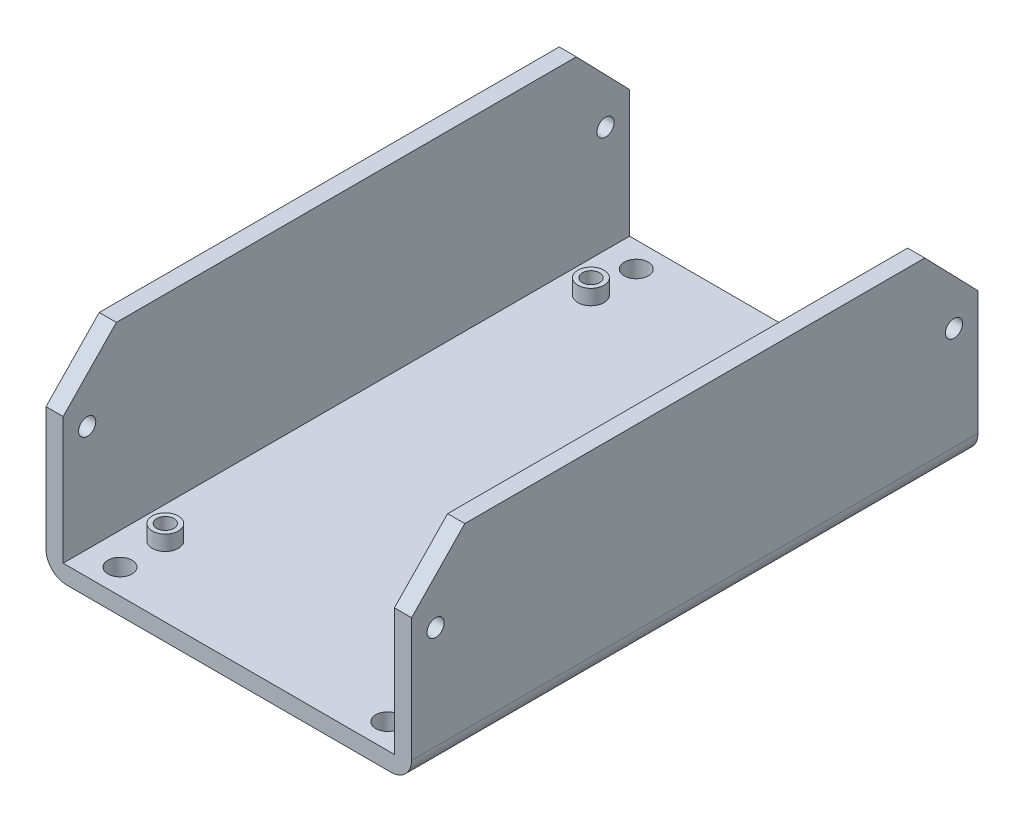
from build123d import *

# Parameters (mm, degrees)
EXTRUDE_1_DEPTH          = 41.25
CUT_EXTRUDE_1_DEPTH      = 58.02151458
CUT_EXTRUDE_1_DEPTH_BACK = 58.02151458
SKETCH_4_R               = 1.75
CUT_EXTRUDE_2_DEPTH      = 10
HOLE_WIZARD_M31_REACH    = 75.336
HOLE_WIZARD_M31_BORE_R   = 1.25
HOLE_WIZARD_M32_D        = 2.5
SKETCH_10_R              = 1.9
EXTRUDE_2_DEPTH          = 2.2
HOLE_WIZARD_M33_D        = 2.5


with BuildPart() as part:
    # Эскиз1 → Бобышка-Вытянуть1 (new, symmetric)
    with BuildSketch(Plane.XY):
        with BuildLine():
            Line((-26.625, 29), (-26.625, 3))
            ThreePointArc((-26.625, 3), (-25.746320344, 0.878679656), (-23.625, 0))
            Line((-23.625, 0), (23.625, 0))
            ThreePointArc((23.625, 0), (25.746320344, 0.878679656), (26.625, 3))
            Line((26.625, 3), (26.625, 29))
            Line((26.625, 29), (24.125, 29))
            Line((24.125, 29), (24.125, 2.5))
            Line((24.125, 2.5), (-24.125, 2.5))
            Line((-24.125, 2.5), (-24.125, 29))
            Line((-24.125, 29), (-26.625, 29))
        make_face()
    extrude(amount=EXTRUDE_1_DEPTH, both=True)

    # Эскиз3 → Вырез-Вытянуть1 (cut, two sides: drawn at the far end of the back side and taken through both)
    with BuildSketch(Plane(origin=(0, 0, 0), x_dir=(0, 0, -1), z_dir=(1, 0, 0)).offset(-CUT_EXTRUDE_1_DEPTH_BACK)):
        Polygon((41.25, 21), (41.25, 29), (33.5, 29), align=None)
        Polygon((-41.25, 21), (-41.25, 29), (-33.5, 29), align=None)
    extrude(amount=CUT_EXTRUDE_1_DEPTH + CUT_EXTRUDE_1_DEPTH_BACK, mode=Mode.SUBTRACT)

    # Эскиз4 → Вырез-Вытянуть2 (cut)
    with BuildSketch(Plane.XZ):
        with Locations((-19.5, -37.6)):
            Circle(SKETCH_4_R)
        with Locations((-19.5, 37.6)):
            Circle(SKETCH_4_R)
        with Locations((19.5, 37.6)):
            Circle(SKETCH_4_R)
        with Locations((19.5, -37.6)):
            Circle(SKETCH_4_R)
    extrude(amount=-CUT_EXTRUDE_2_DEPTH, mode=Mode.SUBTRACT)

    # Отверстие обработанное метчиком M31 bore → Отверстие обработанное метчиком M31 (cut, up to next)
    with BuildSketch(Plane(origin=(26.625, 0, 0), x_dir=(0, 0, -1), z_dir=(1, 0, 0)), mode=Mode.PRIVATE) as hole_wizard_m31_sk1:
        with Locations((37.75, 18)):
            Circle(HOLE_WIZARD_M31_BORE_R)
    hole_wizard_m31_tool1 = extrude(hole_wizard_m31_sk1.sketch, amount=-HOLE_WIZARD_M31_REACH, mode=Mode.PRIVATE) & part.part
    # Отверстие обработанное метчиком M31 bore → Отверстие обработанное метчиком M31 (cut, up to next)
    with BuildSketch(Plane(origin=(26.625, 0, 0), x_dir=(0, 0, -1), z_dir=(1, 0, 0)), mode=Mode.PRIVATE) as hole_wizard_m31_sk2:
        with Locations((-37.75, 18)):
            Circle(HOLE_WIZARD_M31_BORE_R)
    hole_wizard_m31_tool2 = extrude(hole_wizard_m31_sk2.sketch, amount=-HOLE_WIZARD_M31_REACH, mode=Mode.PRIVATE) & part.part
    add(hole_wizard_m31_tool1.solids().sort_by_distance((26.625, 18, -37.75))[0], mode=Mode.SUBTRACT)
    add(hole_wizard_m31_tool2.solids().sort_by_distance((26.625, 18, 37.75))[0], mode=Mode.SUBTRACT)

    # Отверстие обработанное метчиком M32 (through all)
    with Locations(Plane.ZY.offset(26.625)):
        with Locations((-37.75, 18), (37.75, 18)):
            Hole(HOLE_WIZARD_M32_D / 2)

    # Эскиз10 → Бобышка-Вытянуть2 (add)
    with BuildSketch(Plane(origin=(0, 2.5, 0), x_dir=(1, 0, 0), z_dir=(0, 1, 0))):
        with Locations(Location((19.5, 31, 0), (0, 0, 90))):
            Circle(SKETCH_10_R)
        with Locations(Location((19.5, -31, 0), (0, 0, 90))):
            Circle(SKETCH_10_R)
        with Locations(Location((-19.5, -31, 0), (0, 0, 90))):
            Circle(SKETCH_10_R)
        with Locations(Location((-19.5, 31, 0), (0, 0, 90))):
            Circle(SKETCH_10_R)
    extrude(amount=EXTRUDE_2_DEPTH)

    # Отверстие обработанное метчиком M33 (through all)
    with Locations(Plane(origin=(0, 4.7, 0), x_dir=(1, 0, 0), z_dir=(0, 1, 0))):
        with Locations((19.5, 31), (-19.5, 31), (19.5, -31), (-19.5, -31)):
            Hole(HOLE_WIZARD_M33_D / 2)


solid = part.part
